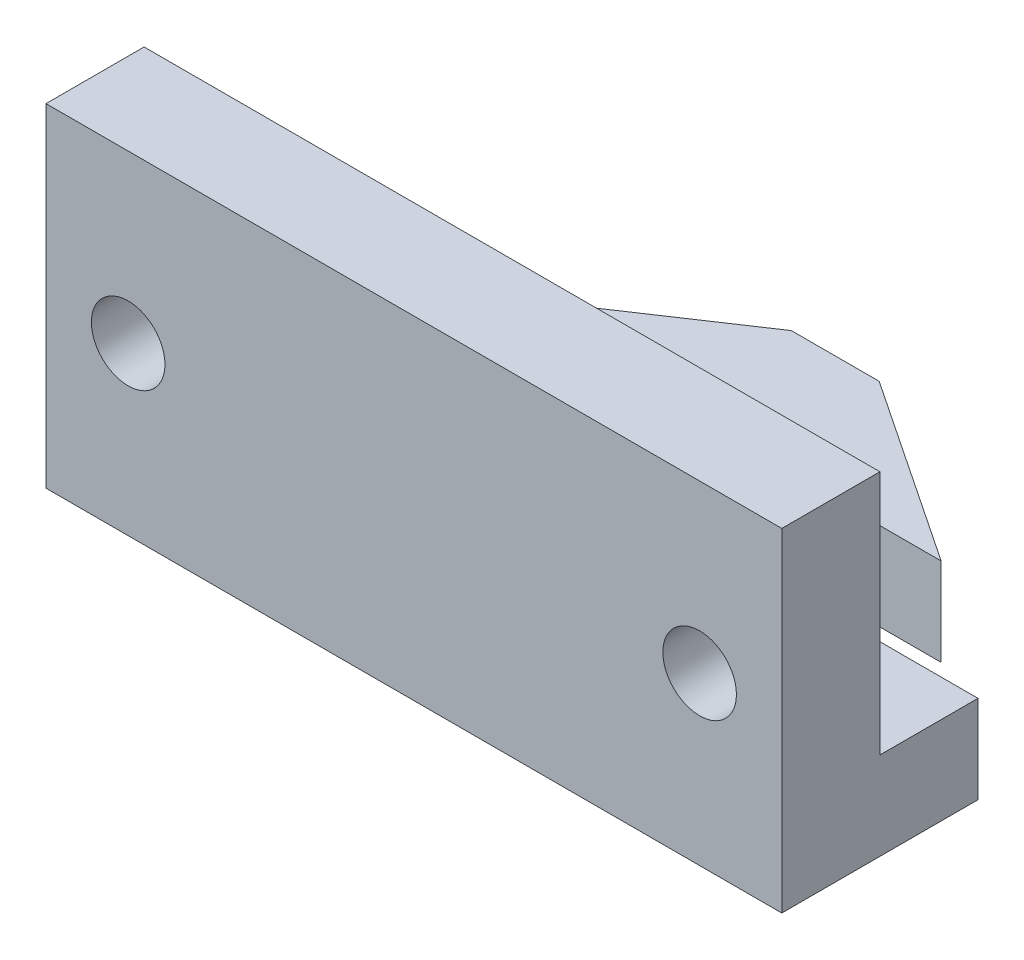
from build123d import *

# Parameters (mm, degrees)
BOSS_EXTRUDE1_DEPTH = 3.5814
SKETCH2_W           = 30
SKETCH2_H           = 4
BOSS_EXTRUDE2_DEPTH = 10
SKETCH3_R           = 1.5
CUT_EXTRUDE1_DEPTH  = 10.05


with BuildPart() as part:
    # Sketch1 → Boss-Extrude1 (new body)
    with BuildSketch(Plane(origin=(0, 0, 0), x_dir=(1, 0, 0), z_dir=(0, 1, 0))):
        Polygon((-15, -10.05), (15, -10.05), (15, -2.05), (1.7907, -2.05), (1.7907, 2.05), (9.398, 2.05), (1.7907, 7.13), (-1.7907, 7.13), (-9.398, 2.05), (-1.7907, 2.05), (-1.7907, -2.05), (-15, -2.05), align=None)
    extrude(amount=BOSS_EXTRUDE1_DEPTH)

    # Sketch2 → Boss-Extrude2 (add)
    with BuildSketch(Plane(origin=(0, 3.5814, 0), x_dir=(1, 0, 0), z_dir=(0, 1, 0))):
        with Locations((0, -8.05)):
            Rectangle(SKETCH2_W, SKETCH2_H)
    extrude(amount=BOSS_EXTRUDE2_DEPTH)

    # Sketch3 → Cut-Extrude1 (cut)
    with BuildSketch(Plane.XY.offset(10.05)):
        with Locations((-11.65, 6.7907)):
            Circle(SKETCH3_R)
        with Locations((11.65, 6.7907)):
            Circle(SKETCH3_R)
    extrude(amount=-CUT_EXTRUDE1_DEPTH, mode=Mode.SUBTRACT)


solid = part.part
